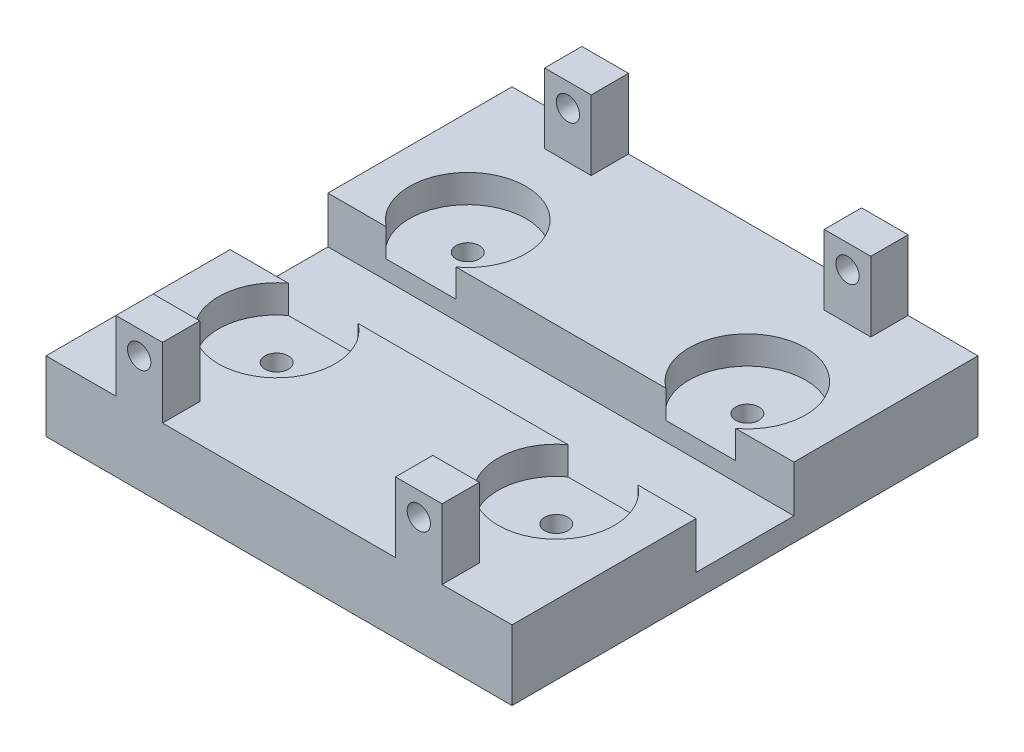
from build123d import *

# Parameters (mm, degrees)
SKETCH1_W           = 1000
SKETCH1_H           = 1000
BOSS_EXTRUDE1_DEPTH = 300
SKETCH2_W           = 1000
SKETCH2_H           = 200
CUT_EXTRUDE1_DEPTH  = 100
MOVE_FACE1_BY       = 150
SCALE1_SCALE        = 0.1
SKETCH5_R           = 12.5
CUT_EXTRUDE4_DEPTH  = 6
SKETCH11_R          = 12.5
CUT_EXTRUDE5_DEPTH  = 6
SKETCH12_R          = 12.5
CUT_EXTRUDE6_DEPTH  = 6
SKETCH13_R          = 12.5
CUT_EXTRUDE7_DEPTH  = 6
CUT_EXTRUDE8_DEPTH  = 3
SKETCH15_R          = 2.5
CUT_EXTRUDE9_DEPTH  = 16
CUT_EXTRUDE10_DEPTH = 3
SKETCH17_R          = 2.5
CUT_EXTRUDE11_DEPTH = 10
CUT_EXTRUDE12_DEPTH = 3
SKETCH19_R          = 2.5
CUT_EXTRUDE13_DEPTH = 10
CUT_EXTRUDE14_DEPTH = 3
SKETCH21_R          = 2.5
CUT_EXTRUDE15_DEPTH = 10
SKETCH27_W          = 10
SKETCH27_H          = 8
BOSS_EXTRUDE3_DEPTH = 15
CUT_EXTRUDE21_REACH = 529.87
SKETCH28_R          = 2.5
SKETCH30_W          = 10
SKETCH30_H          = 8
BOSS_EXTRUDE4_DEPTH = 15
SKETCH31_R          = 2.5
CUT_EXTRUDE22_DEPTH = 8
SKETCH32_W          = 10
SKETCH32_H          = 8
BOSS_EXTRUDE5_DEPTH = 15
CUT_EXTRUDE23_START = -8
SKETCH33_R          = 2.5
CUT_EXTRUDE23_DEPTH = 8
SKETCH34_W          = 10
SKETCH34_H          = 8
BOSS_EXTRUDE6_DEPTH = 15
CUT_EXTRUDE24_START = -8
SKETCH35_R          = 2.5
CUT_EXTRUDE24_DEPTH = 8
SKETCH40_W          = 100
SKETCH40_H          = 10
CUT_EXTRUDE25_DEPTH = 0.5
SKETCH41_W          = 100
SKETCH41_H          = 10
CUT_EXTRUDE26_DEPTH = 0.5


with BuildPart() as part:
    # Sketch1 → Boss-Extrude1 (new body)
    with BuildSketch(Plane(origin=(0, 0, 0), x_dir=(1, 0, 0), z_dir=(0, 1, 0))):
        with Locations((-407.266206583, -460.379609426)):
            Rectangle(SKETCH1_W, SKETCH1_H)
    extrude(amount=BOSS_EXTRUDE1_DEPTH)

    # Sketch2 → Cut-Extrude1 (cut)
    with BuildSketch(Plane(origin=(0, 300, 0), x_dir=(1, 0, 0), z_dir=(0, 1, 0))):
        with Locations((-407.266206583, -460.379609426)):
            Rectangle(SKETCH2_W, SKETCH2_H)
    extrude(amount=-CUT_EXTRUDE1_DEPTH, mode=Mode.SUBTRACT)

    # Move Face1: a face moved inward by 150.0
    extrude(part.faces().sort_by_distance((-407.266206583, 0, 460.379609426))[0], amount=MOVE_FACE1_BY, dir=(0, 1, 0), mode=Mode.SUBTRACT)


with BuildPart() as part_1:
    # Scale1: scaled about (-407.266206583, 221.153846154, 460.379609426)
    add(part.part.scale(SCALE1_SCALE).moved(Location((-366.539585925, 199.038461539, 414.341648483))))

    # Sketch5 → Cut-Extrude4 (cut)
    with BuildSketch(Plane(origin=(0, 229.038461538, 0), x_dir=(1, 0, 0), z_dir=(0, 1, 0))):
        with Locations((-437.266206583, -439.879609426)):
            Circle(SKETCH5_R)
    extrude(amount=-CUT_EXTRUDE4_DEPTH, mode=Mode.SUBTRACT)

    # Sketch11 → Cut-Extrude5 (cut)
    with BuildSketch(Plane(origin=(0, 229.038461538, 0), x_dir=(1, 0, 0), z_dir=(0, 1, 0))):
        with Locations((-377.266206583, -439.879609426)):
            Circle(SKETCH11_R)
    extrude(amount=-CUT_EXTRUDE5_DEPTH, mode=Mode.SUBTRACT)

    # Sketch12 → Cut-Extrude6 (cut)
    with BuildSketch(Plane(origin=(0, 229.038461538, 0), x_dir=(1, 0, 0), z_dir=(0, 1, 0))):
        with Locations((-377.266206583, -480.879609426)):
            Circle(SKETCH12_R)
    extrude(amount=-CUT_EXTRUDE6_DEPTH, mode=Mode.SUBTRACT)

    # Sketch13 → Cut-Extrude7 (cut)
    with BuildSketch(Plane(origin=(0, 229.038461538, 0), x_dir=(1, 0, 0), z_dir=(0, 1, 0))):
        with Locations((-437.266206583, -480.879609426)):
            Circle(SKETCH13_R)
    extrude(amount=-CUT_EXTRUDE7_DEPTH, mode=Mode.SUBTRACT)

    # Sketch14 → Cut-Extrude8 (cut)
    with BuildSketch(Plane(origin=(0, 214.038461538, 0), x_dir=(-1, 0, 0), z_dir=(0, -1, 0))):
        Polygon((377.266206583, -444.527279093), (381.291206583, -442.20344426), (381.291206583, -437.555774593), (377.266206583, -435.231939759), (373.241206583, -437.555774593), (373.241206583, -442.20344426), align=None)
    extrude(amount=-CUT_EXTRUDE8_DEPTH, mode=Mode.SUBTRACT)

    # Sketch15 → Cut-Extrude9 (cut)
    with BuildSketch(Plane(origin=(0, 217.038461538, 0), x_dir=(-1, 0, 0), z_dir=(0, -1, 0))):
        with Locations(Location((377.266206583, -439.879609426, 0), (0, 0, 90))):
            Circle(SKETCH15_R)
    extrude(amount=-CUT_EXTRUDE9_DEPTH, mode=Mode.SUBTRACT)

    # Sketch16 → Cut-Extrude10 (cut)
    with BuildSketch(Plane(origin=(0, 214.038461538, 0), x_dir=(-1, 0, 0), z_dir=(0, -1, 0))):
        Polygon((437.266206583, -444.527279093), (441.291206583, -442.20344426), (441.291206583, -437.555774593), (437.266206583, -435.231939759), (433.241206583, -437.555774593), (433.241206583, -442.20344426), align=None)
    extrude(amount=-CUT_EXTRUDE10_DEPTH, mode=Mode.SUBTRACT)

    # Sketch17 → Cut-Extrude11 (cut)
    with BuildSketch(Plane(origin=(0, 217.038461538, 0), x_dir=(-1, 0, 0), z_dir=(0, -1, 0))):
        with Locations(Location((437.266206583, -439.879609426, 0), (0, 0, 90))):
            Circle(SKETCH17_R)
    extrude(amount=-CUT_EXTRUDE11_DEPTH, mode=Mode.SUBTRACT)

    # Sketch18 → Cut-Extrude12 (cut)
    with BuildSketch(Plane(origin=(0, 214.038461538, 0), x_dir=(-1, 0, 0), z_dir=(0, -1, 0))):
        Polygon((377.266206583, -485.527279093), (381.291206583, -483.20344426), (381.291206583, -478.555774593), (377.266206583, -476.231939759), (373.241206583, -478.555774593), (373.241206583, -483.20344426), align=None)
    extrude(amount=-CUT_EXTRUDE12_DEPTH, mode=Mode.SUBTRACT)

    # Sketch19 → Cut-Extrude13 (cut)
    with BuildSketch(Plane(origin=(0, 217.038461538, 0), x_dir=(-1, 0, 0), z_dir=(0, -1, 0))):
        with Locations(Location((377.266206583, -480.879609426, 0), (0, 0, 90))):
            Circle(SKETCH19_R)
    extrude(amount=-CUT_EXTRUDE13_DEPTH, mode=Mode.SUBTRACT)

    # Sketch20 → Cut-Extrude14 (cut)
    with BuildSketch(Plane(origin=(0, 214.038461538, 0), x_dir=(-1, 0, 0), z_dir=(0, -1, 0))):
        Polygon((437.266206583, -485.527279093), (441.291206583, -483.20344426), (441.291206583, -478.555774593), (437.266206583, -476.231939759), (433.241206583, -478.555774593), (433.241206583, -483.20344426), align=None)
    extrude(amount=-CUT_EXTRUDE14_DEPTH, mode=Mode.SUBTRACT)

    # Sketch21 → Cut-Extrude15 (cut)
    with BuildSketch(Plane(origin=(0, 217.038461538, 0), x_dir=(-1, 0, 0), z_dir=(0, -1, 0))):
        with Locations(Location((437.266206583, -480.879609426, 0), (0, 0, 90))):
            Circle(SKETCH21_R)
    extrude(amount=-CUT_EXTRUDE15_DEPTH, mode=Mode.SUBTRACT)

    # Sketch27 → Boss-Extrude3 (add)
    with BuildSketch(Plane(origin=(0, 229.038461538, 0), x_dir=(1, 0, 0), z_dir=(0, 1, 0))):
        with Locations((-437.266206583, -506.379609426)):
            Rectangle(SKETCH27_W, SKETCH27_H)
    extrude(amount=BOSS_EXTRUDE3_DEPTH)

    # Sketch28 → Cut-Extrude21 (cut, up to next)
    with BuildSketch(Plane.XY.offset(510.379609426), mode=Mode.PRIVATE) as cut_extrude21_sk1:
        with Locations((-437.266206583, 239.038461538)):
            Circle(SKETCH28_R)
    cut_extrude21_tool1 = extrude(cut_extrude21_sk1.sketch, amount=-CUT_EXTRUDE21_REACH, mode=Mode.PRIVATE) & part_1.part
    add(cut_extrude21_tool1.solids().sort_by_distance((-437.266207, 239.038462, 510.379609))[0], mode=Mode.SUBTRACT)

    # Sketch30 → Boss-Extrude4 (add)
    with BuildSketch(Plane(origin=(0, 229.038461538, 0), x_dir=(1, 0, 0), z_dir=(0, 1, 0))):
        with Locations((-377.266206583, -506.379609426)):
            Rectangle(SKETCH30_W, SKETCH30_H)
    extrude(amount=BOSS_EXTRUDE4_DEPTH)

    # Sketch31 → Cut-Extrude22 (cut)
    with BuildSketch(Plane.XY.offset(510.379609426)):
        with Locations((-377.266206583, 239.038461538)):
            Circle(SKETCH31_R)
    extrude(amount=-CUT_EXTRUDE22_DEPTH, mode=Mode.SUBTRACT)

    # Sketch32 → Boss-Extrude5 (add)
    with BuildSketch(Plane(origin=(0, 229.038461538, 0), x_dir=(1, 0, 0), z_dir=(0, 1, 0))):
        with Locations((-437.266206583, -414.379609426)):
            Rectangle(SKETCH32_W, SKETCH32_H)
    extrude(amount=BOSS_EXTRUDE5_DEPTH)

    # Sketch33 → Cut-Extrude23 (cut)
    with BuildSketch(Plane(origin=(0, 0, 410.379609426), x_dir=(-1, 0, 0), z_dir=(0, 0, -1)).offset(CUT_EXTRUDE23_START)):
        with Locations(Location((437.266206583, 239.038461538, 0), (0, 0, 180))):
            Circle(SKETCH33_R)
    extrude(amount=CUT_EXTRUDE23_DEPTH, mode=Mode.SUBTRACT)

    # Sketch34 → Boss-Extrude6 (add)
    with BuildSketch(Plane(origin=(0, 229.038461538, 0), x_dir=(1, 0, 0), z_dir=(0, 1, 0))):
        with Locations((-377.266206583, -414.379609426)):
            Rectangle(SKETCH34_W, SKETCH34_H)
    extrude(amount=BOSS_EXTRUDE6_DEPTH)

    # Sketch35 → Cut-Extrude24 (cut)
    with BuildSketch(Plane(origin=(0, 0, 410.379609426), x_dir=(-1, 0, 0), z_dir=(0, 0, -1)).offset(CUT_EXTRUDE24_START)):
        with Locations(Location((377.266206583, 239.038461538, 0), (0, 0, 180))):
            Circle(SKETCH35_R)
    extrude(amount=CUT_EXTRUDE24_DEPTH, mode=Mode.SUBTRACT)

    # Sketch40 → Cut-Extrude25 (cut)
    with BuildSketch(Plane(origin=(0, 0, 470.379609426), x_dir=(-1, 0, 0), z_dir=(0, 0, -1))):
        with Locations((407.266206583, 224.038461538)):
            Rectangle(SKETCH40_W, SKETCH40_H)
    extrude(amount=-CUT_EXTRUDE25_DEPTH, mode=Mode.SUBTRACT)

    # Sketch41 → Cut-Extrude26 (cut)
    with BuildSketch(Plane.XY.offset(450.379609426)):
        with Locations((-407.266206583, 224.038461538)):
            Rectangle(SKETCH41_W, SKETCH41_H)
    extrude(amount=-CUT_EXTRUDE26_DEPTH, mode=Mode.SUBTRACT)


solid = part_1.part
